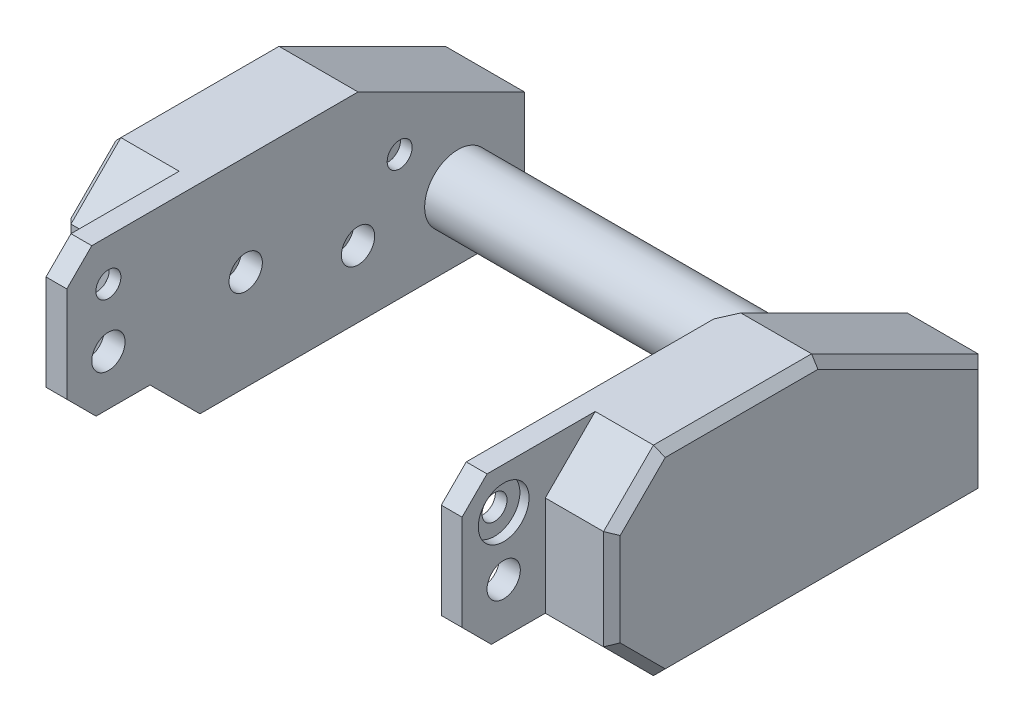
from build123d import *

# Parameters (mm, degrees)
SKETCH2_W                      = 45
SKETCH2_H                      = 24
BOSS_EXTRUDE1_DEPTH            = 50
CUT_EXTRUDE7_DEPTH             = 50
CHAMFER4_SIZE                  = 6
CUT_EXTRUDE1_REACH             = 70.33
SKETCH3_W                      = 45
SKETCH3_H                      = 10
CUT_EXTRUDE2_REACH             = 55.912
SKETCH4_R                      = 2
CUT_EXTRUDE2_DIRECTION_2_REACH = 55.912
SKETCH8_W                      = 45
SKETCH8_H                      = 50
CUT_EXTRUDE4_DEPTH             = 14
SKETCH6_R                      = 4
BOSS_EXTRUDE2_DEPTH            = 45
CUT_EXTRUDE3_START             = -50
SKETCH7_R                      = 2
CUT_EXTRUDE3_DEPTH             = 50
CUT_EXTRUDE6_START             = -2.5
SKETCH13_R                     = 2
CUT_EXTRUDE6_DEPTH             = 50
BOSS_EXTRUDE16_REACH           = 58.127
CUT_EXTRUDE13_REACH            = 64.292
SKETCH30_W                     = 45
SKETCH30_H                     = 10
CUT_EXTRUDE18_START            = -50
SKETCH37_R                     = 2
CUT_EXTRUDE18_DEPTH            = 50
CUT_EXTRUDE20_REACH            = 62.83
SKETCH43_R                     = 1.5
SKETCH44_R                     = 3.05
CUT_EXTRUDE21_DEPTH            = 1.1
SKETCH45_R                     = 3.05
CUT_EXTRUDE22_DEPTH            = 1.1
BOSS_EXTRUDE23_DEPTH           = 2.5
BOSS_EXTRUDE24_DEPTH           = 2.5
SKETCH55_R                     = 3.05
CUT_EXTRUDE28_DEPTH            = 1.1
CUT_EXTRUDE29_START            = -50
SKETCH57_R                     = 1.5
CUT_EXTRUDE29_DEPTH            = 48.9
SKETCH58_R                     = 3.05
CUT_EXTRUDE30_DEPTH            = 1.1
CHAMFER11_SIZE                 = 3
BOSS_EXTRUDE19_DEPTH           = 8
BOSS_EXTRUDE20_DEPTH           = 8
CHAMFER7_SIZE                  = 1
CHAMFER8_SIZE                  = 1


with BuildPart() as part:
    # Sketch2 → Boss-Extrude1 (new body)
    with BuildSketch(Plane(origin=(0, 0, 0), x_dir=(0, 0, -1), z_dir=(1, 0, 0))):
        Rectangle(SKETCH2_W, SKETCH2_H)
    extrude(amount=BOSS_EXTRUDE1_DEPTH)

    # Sketch14 → Cut-Extrude7 (cut)
    with BuildSketch(Plane(origin=(50, 0, 0), x_dir=(0, 0, -1), z_dir=(1, 0, 0))):
        Polygon((2.5, 12), (22.5, 2), (22.5, 12), align=None)
    extrude(amount=-CUT_EXTRUDE7_DEPTH, mode=Mode.SUBTRACT)

    # Chamfer4
    chamfer4_edges = [part.edges().sort_by_distance(p)[0] for p in [
        (25, -12, 22.5),
        (25, 12, 22.5),
    ]]
    chamfer(chamfer4_edges, length=CHAMFER4_SIZE)

    # Cut-Extrude1: up to this face of the body (flat: up to its plane)
    cut_extrude1_end = Plane(part.part.faces().sort_by_distance((25, 0, 22.5))[0])
    # Sketch3 → Cut-Extrude1 (cut, up to the picked face)
    with BuildSketch(Plane(origin=(0, 0, -22.5), x_dir=(-1, 0, 0), z_dir=(0, 0, -1)), mode=Mode.PRIVATE) as cut_extrude1_sk1:
        with Locations((-25, -7)):
            Rectangle(SKETCH3_W, SKETCH3_H)
    cut_extrude1_tool1 = split(extrude(cut_extrude1_sk1.sketch, amount=-CUT_EXTRUDE1_REACH, mode=Mode.PRIVATE), bisect_by=cut_extrude1_end, keep=Keep.BOTH, mode=Mode.PRIVATE)
    add(cut_extrude1_tool1.solids().sort_by(Axis((25, -7, -22.5), (0, 0, 1)))[0], mode=Mode.SUBTRACT)

    # Cut-Extrude2: up to this face of the body (flat: up to its plane)
    cut_extrude2_end = Plane(part.part.faces().sort_by_distance((50, -0.918079096, 0.895480226))[0])
    # Sketch4 → Cut-Extrude2 (cut, up to the picked face)
    with BuildSketch(Plane(origin=(2.5, 0, 0), x_dir=(0, 0, -1), z_dir=(1, 0, 0)), mode=Mode.PRIVATE) as cut_extrude2_sk1:
        with Locations(Location((14.5, -4, 0), (0, 0, 180))):
            Circle(SKETCH4_R)
    cut_extrude2_tool1 = split(extrude(cut_extrude2_sk1.sketch, amount=CUT_EXTRUDE2_REACH, mode=Mode.PRIVATE), bisect_by=cut_extrude2_end, keep=Keep.BOTH, mode=Mode.PRIVATE)
    add(cut_extrude2_tool1.solids().sort_by(Axis((2.5, -4, -14.5), (1, 0, 0)))[0], mode=Mode.SUBTRACT)

    # Cut-Extrude2 direction 2: up to this face of the body (flat: up to its plane)
    cut_extrude2_direction_2_end = Plane(part.part.faces().sort_by_distance((0, -0.918079096, 0.895480226))[0])
    # Sketch4 → Cut-Extrude2 direction 2 (cut, up to the picked face)
    with BuildSketch(Plane(origin=(2.5, 0, 0), x_dir=(0, 0, -1), z_dir=(1, 0, 0)), mode=Mode.PRIVATE) as cut_extrude2_direction_2_sk1:
        with Locations(Location((14.5, -4, 0), (0, 0, 180))):
            Circle(SKETCH4_R)
    cut_extrude2_direction_2_tool1 = split(extrude(cut_extrude2_direction_2_sk1.sketch, amount=-CUT_EXTRUDE2_DIRECTION_2_REACH, mode=Mode.PRIVATE), bisect_by=cut_extrude2_direction_2_end, keep=Keep.BOTH, mode=Mode.PRIVATE)
    add(cut_extrude2_direction_2_tool1.solids().sort_by(Axis((2.5, -4, -14.5), (-1, 0, 0)))[0], mode=Mode.SUBTRACT)

    # Sketch8 → Cut-Extrude4 (cut)
    with BuildSketch(Plane(origin=(0, 12, 0), x_dir=(1, 0, 0), z_dir=(0, 1, 0))):
        with Locations((25, 2.5)):
            Rectangle(SKETCH8_W, SKETCH8_H)
    extrude(amount=-CUT_EXTRUDE4_DEPTH, mode=Mode.SUBTRACT)


with BuildPart() as cut_extrude4_piece_1:
    # of the separate pieces the step leaves, piece 1, a body of its own (cut_extrude4_pieces)
    add(part.part.solids().sort_by_distance((0, -12, 16.5))[0])


with BuildPart() as cut_extrude4_piece_2:
    # of the separate pieces the step leaves, piece 2, a body of its own (cut_extrude4_pieces)
    add(part.part.solids().sort_by_distance((50, 2, -22.5))[0])

    # Sketch6 → Boss-Extrude2 (add)
    with BuildSketch(Plane(origin=(2.5, 0, 0), x_dir=(0, 0, -1), z_dir=(1, 0, 0))):
        with Locations(Location((14.5, -4, 0), (0, 0, 180))):
            Circle(SKETCH6_R)
    extrude(amount=BOSS_EXTRUDE2_DEPTH)


with BuildPart() as cut_extrude3_tool:
    # Sketch7 → Cut-Extrude3 (new body)
    with BuildSketch(Plane.ZY.offset(CUT_EXTRUDE3_START)):
        with Locations((11, 0)):
            Circle(SKETCH7_R)
    extrude(amount=CUT_EXTRUDE3_DEPTH)


with BuildPart() as cut_extrude4_piece_1_1:
    add(cut_extrude4_piece_1.part)

    # Cut-Extrude3: cut by cut_extrude3_tool
    add(cut_extrude3_tool.part, mode=Mode.SUBTRACT)


with BuildPart() as cut_extrude4_piece_2_1:
    add(cut_extrude4_piece_2.part)

    # Cut-Extrude3: cut by cut_extrude3_tool
    add(cut_extrude3_tool.part, mode=Mode.SUBTRACT)


with BuildPart() as cut_extrude6_tool:
    # Sketch13 → Cut-Extrude6 (new body)
    with BuildSketch(Plane.ZY.offset(-47.5).offset(CUT_EXTRUDE6_START)):
        with Locations(Location((-2.5, -4, 0), (0, 0, 270))):
            Circle(SKETCH13_R)
    extrude(amount=CUT_EXTRUDE6_DEPTH)


with BuildPart() as cut_extrude4_piece_1_2:
    add(cut_extrude4_piece_1_1.part)

    # Cut-Extrude6: cut by cut_extrude6_tool
    add(cut_extrude6_tool.part, mode=Mode.SUBTRACT)


with BuildPart() as cut_extrude4_piece_2_2:
    add(cut_extrude4_piece_2_1.part)

    # Cut-Extrude6: cut by cut_extrude6_tool
    add(cut_extrude6_tool.part, mode=Mode.SUBTRACT)

    # Boss-Extrude16: up to this face of the body (flat: up to its plane)
    boss_extrude16_end = Plane(cut_extrude4_piece_2_2.part.faces().sort_by_distance((50, -0.845343651, 1.015922603))[0])
    # Sketch29 → Boss-Extrude16 (add, up to the picked face)
    with BuildSketch(Plane.ZY, mode=Mode.PRIVATE) as boss_extrude16_sk1:
        Polygon((28.985281374, 6), (22.5, 6), (22.5, -6), (28.985281374, -6), (32.5, -2.485281374), (32.5, 2.485281374), align=None)
    boss_extrude16_tool1 = split(extrude(boss_extrude16_sk1.sketch, amount=-BOSS_EXTRUDE16_REACH, mode=Mode.PRIVATE), bisect_by=boss_extrude16_end, keep=Keep.BOTH, mode=Mode.PRIVATE)

    add(cut_extrude4_piece_1_2.part)  # Boss-Extrude16 merges Cut-Extrude4 piece 1
    add(boss_extrude16_tool1.solids().sort_by(Axis((0, 0, 27.06066), (1, 0, 0)))[0])

    # Cut-Extrude13: up to this plane
    cut_extrude13_end = Plane(origin=(65.620499352, -6, 28.985281374), z_dir=(0, -0.7071067811865474, 0.7071067811865477))
    # Sketch30 → Cut-Extrude13 (cut, up to the surface)
    with BuildSketch(Plane(origin=(0, 6, 0), x_dir=(1, 0, 0), z_dir=(0, 1, 0)), mode=Mode.PRIVATE) as cut_extrude13_sk1:
        with Locations((25, -27.5)):
            Rectangle(SKETCH30_W, SKETCH30_H)
    cut_extrude13_tool1 = split(extrude(cut_extrude13_sk1.sketch, amount=-CUT_EXTRUDE13_REACH, mode=Mode.PRIVATE), bisect_by=cut_extrude13_end, keep=Keep.BOTH, mode=Mode.PRIVATE)
    add(cut_extrude13_tool1.solids().sort_by_distance((25, 6, 27.5))[0], mode=Mode.SUBTRACT)

    # Sketch37 → Cut-Extrude18 (cut)
    with BuildSketch(Plane.ZY.offset(CUT_EXTRUDE18_START)):
        with Locations((27.5, 0)):
            Circle(SKETCH37_R)
    extrude(amount=CUT_EXTRUDE18_DEPTH, mode=Mode.SUBTRACT)

    # Cut-Extrude20: up to this face of the body (flat: up to its plane)
    cut_extrude20_end = Plane(cut_extrude4_piece_2_2.part.faces().sort_by_distance((0, -0.765078921, 3.483337135))[0])
    # Sketch43 → Cut-Extrude20 (cut, up to the picked face)
    with BuildSketch(Plane(origin=(50, 0, 0), x_dir=(0, 0, -1), z_dir=(1, 0, 0)), mode=Mode.PRIVATE) as cut_extrude20_sk1:
        with Locations((7.5, 3)):
            Circle(SKETCH43_R)
    cut_extrude20_tool1 = split(extrude(cut_extrude20_sk1.sketch, amount=-CUT_EXTRUDE20_REACH, mode=Mode.PRIVATE), bisect_by=cut_extrude20_end, keep=Keep.BOTH, mode=Mode.PRIVATE)
    add(cut_extrude20_tool1.solids().sort_by(Axis((50, 3, -7.5), (-1, 0, 0)))[0], mode=Mode.SUBTRACT)

    # Sketch44 → Cut-Extrude21 (cut)
    with BuildSketch(Plane(origin=(50, 0, 0), x_dir=(0, 0, -1), z_dir=(1, 0, 0))):
        with Locations((7.5, 3)):
            Circle(SKETCH44_R)
    extrude(amount=-CUT_EXTRUDE21_DEPTH, mode=Mode.SUBTRACT)

    # Sketch45 → Cut-Extrude22 (cut)
    with BuildSketch(Plane.ZY):
        with Locations(Location((-7.5, 3, 0), (0, 0, 180))):
            Circle(SKETCH45_R)
    extrude(amount=-CUT_EXTRUDE22_DEPTH, mode=Mode.SUBTRACT)

    # Sketch48 → Boss-Extrude23 (add)
    with BuildSketch(Plane(origin=(50, 0, 0), x_dir=(0, 0, -1), z_dir=(1, 0, 0))):
        Polygon((-16.5, 12), (-22.5, 6), (-28.985281374, 6), (-32.5, 2.485281374), (-32.5, 12), align=None)
    extrude(amount=-BOSS_EXTRUDE23_DEPTH)

    # Sketch49 → Boss-Extrude24 (add)
    with BuildSketch(Plane.ZY):
        Polygon((28.985281374, 6), (22.5, 6), (16.5, 12), (32.5, 12), (32.5, 2.485281374), align=None)
    extrude(amount=-BOSS_EXTRUDE24_DEPTH)

    # Sketch55 → Cut-Extrude28 (cut)
    with BuildSketch(Plane.ZY):
        with Locations((27.5, 7)):
            Circle(SKETCH55_R)
    extrude(amount=-CUT_EXTRUDE28_DEPTH, mode=Mode.SUBTRACT)

    # Sketch57 → Cut-Extrude29 (cut)
    with BuildSketch(Plane.ZY.offset(CUT_EXTRUDE29_START)):
        with Locations((27.5, 7)):
            Circle(SKETCH57_R)
    extrude(amount=CUT_EXTRUDE29_DEPTH, mode=Mode.SUBTRACT)

    # Sketch58 → Cut-Extrude30 (cut)
    with BuildSketch(Plane(origin=(50, 0, 0), x_dir=(0, 0, -1), z_dir=(1, 0, 0))):
        with Locations(Location((-27.5, 7, 0), (0, 0, 180))):
            Circle(SKETCH58_R)
    extrude(amount=-CUT_EXTRUDE30_DEPTH, mode=Mode.SUBTRACT)

    # Chamfer11
    chamfer11_edges = [cut_extrude4_piece_2_2.edges().sort_by_distance(p)[0] for p in [
        (48.75, 12, 32.5),
        (1.25, 12, 32.5),
    ]]
    chamfer(chamfer11_edges, length=CHAMFER11_SIZE)

    # Sketch38 → Boss-Extrude19 (add)
    with BuildSketch(Plane.ZY):
        Polygon((-2.5, 12), (-22.5, 2), (-22.5, -12), (16.5, -12), (22.5, -6), (22.5, 6), (16.5, 12), align=None)
    extrude(amount=BOSS_EXTRUDE19_DEPTH)

    # Sketch39 → Boss-Extrude20 (add)
    with BuildSketch(Plane(origin=(50, 0, 0), x_dir=(0, 0, -1), z_dir=(1, 0, 0))):
        Polygon((-22.5, 6), (-22.5, -6), (-16.5, -12), (22.5, -12), (22.5, 2), (2.5, 12), (-16.5, 12), align=None)
    extrude(amount=BOSS_EXTRUDE20_DEPTH)

    # Chamfer7
    chamfer7_edges = [cut_extrude4_piece_2_2.edges().sort_by_distance(p)[0] for p in [
        (-8, 12, 7),
        (-8, 7, -12.5),
        (-8, -5, -22.5),
        (-8, -12, -3),
        (-8, -9, 19.5),
        (-8, 0, 22.5),
        (-8, 9, 19.5),
        (58, 9, 19.5),
        (58, 0, 22.5),
        (58, -9, 19.5),
        (58, -12, -3),
        (58, -5, -22.5),
        (58, 7, -12.5),
        (58, 12, 7),
    ]]
    chamfer(chamfer7_edges, length=CHAMFER7_SIZE)

    # Chamfer8
    chamfer8_edges = [cut_extrude4_piece_2_2.edges().sort_by_distance(p)[0] for p in [
        (47.5, -12, -3),
        (47.5, -5, -22.5),
        (47.5, -9, 19.5),
        (47.5, 7, -12.5),
    ]]
    chamfer(chamfer8_edges, length=CHAMFER8_SIZE)


solid = cut_extrude4_piece_2_2.part
